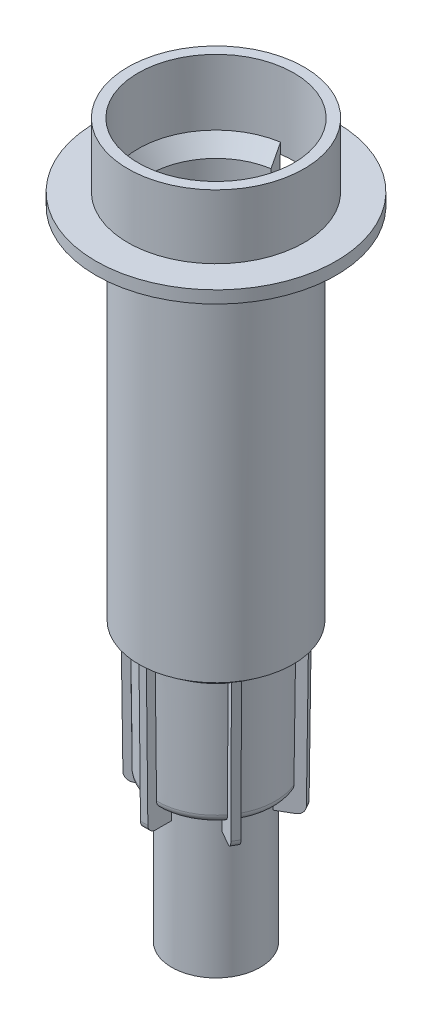
from build123d import *

# Parameters (mm, degrees)
BOSS_EXTRUDE2_DEPTH = 0.9
CIRPATTERN1_COUNT   = 6
CUT_REVOLVE2_ANGLE  = 18.3


with BuildPart() as part:
    # Sketch3 → Revolve2 (revolve)
    with BuildSketch(Plane(origin=(0, 0, 0), x_dir=(0, 0, -1), z_dir=(1, 0, 0))):
        with BuildLine():
            Line((5.4, 0), (5.4, 17.5))
            Line((5.4, 17.5), (6.250057305, 17.5))
            ThreePointArc((6.250057305, 17.5), (6.953368941, 17.789118334), (7.25, 18.489294515))
            Line((7.25, 18.489294515), (7.4, 32.5))
            Line((7.4, 32.5), (9.4, 34))
            Line((9.4, 34), (9.4, 77.7))
            Line((9.4, 77.7), (14.65, 77.7))
            Line((14.65, 77.7), (14.65, 79.2))
            Line((14.65, 79.2), (10.75, 79.2))
            Line((10.75, 79.2), (10.75, 87))
            Line((10.75, 87), (9.5, 87))
            Line((9.5, 87), (9.5, 79))
            Line((9.5, 79), (8.1, 77))
            Line((8.1, 77), (8.1, 34))
            Line((8.1, 34), (6, 32.425))
            Line((6, 32.425), (5.856270621, 19))
            Line((5.856270621, 19), (2.539122418, 14.6))
            Line((2.539122418, 14.6), (2.1, 11.5))
            Line((2.1, 11.5), (2.85, 11.5))
            Line((2.85, 11.5), (3.062478589, 13))
            Line((3.062478589, 13), (3.75, 13))
            Line((3.75, 13), (3.75, 2))
            Line((3.75, 2), (4.4, 0))
            Line((4.4, 0), (5.4, 0))
        make_face()
    revolve(axis=Axis((0, 0, 0), (0, 1, 0)))

    # Sketch4 → Boss-Extrude2 (add)
    with BuildSketch(Plane(origin=(0, 0, 0), x_dir=(0, 0, -1), z_dir=(1, 0, 0))):
        with BuildLine():
            Line((8.5, 34.3), (8.308857775, 16.446417237))
            ThreePointArc((8.308857775, 16.446417237), (8.025083083, 15.776587579), (7.352253864, 15.5))
            Line((7.352253864, 15.5), (3.217630005, 15.5))
            Line((3.217630005, 15.5), (5.856270621, 19))
            Line((5.856270621, 19), (6, 32.425))
            Line((6, 32.425), (8.5, 34.3))
        make_face()
    boss_extrude2 = extrude(amount=BOSS_EXTRUDE2_DEPTH)

    # CirPattern1: Boss-Extrude2 ×6 about axis
    cirpattern1_axis = Axis((0, 0, 0), (0, 1, 0))
    for i in range(1, CIRPATTERN1_COUNT):
        add(boss_extrude2.rotate(cirpattern1_axis, i * 360 / CIRPATTERN1_COUNT))

    # Sketch6 → Cut-Revolve2 (revolve, symmetric, cut)
    with BuildSketch(Plane(origin=(0, 0, 0), x_dir=(0, 0, -1), z_dir=(1, 0, 0))) as cut_revolve2_sk:
        Polygon((8.1, 77), (8.1, 72.4), (9.5, 73.6), (9.5, 79), align=None)
    revolve(axis=Axis((0, 0, 0), (0, 1, 0)), revolution_arc=CUT_REVOLVE2_ANGLE / 2, mode=Mode.SUBTRACT)
    revolve(cut_revolve2_sk.sketch, axis=Axis((0, 0, 0), (0, -1, 0)), revolution_arc=CUT_REVOLVE2_ANGLE / 2, mode=Mode.SUBTRACT)


solid = part.part
